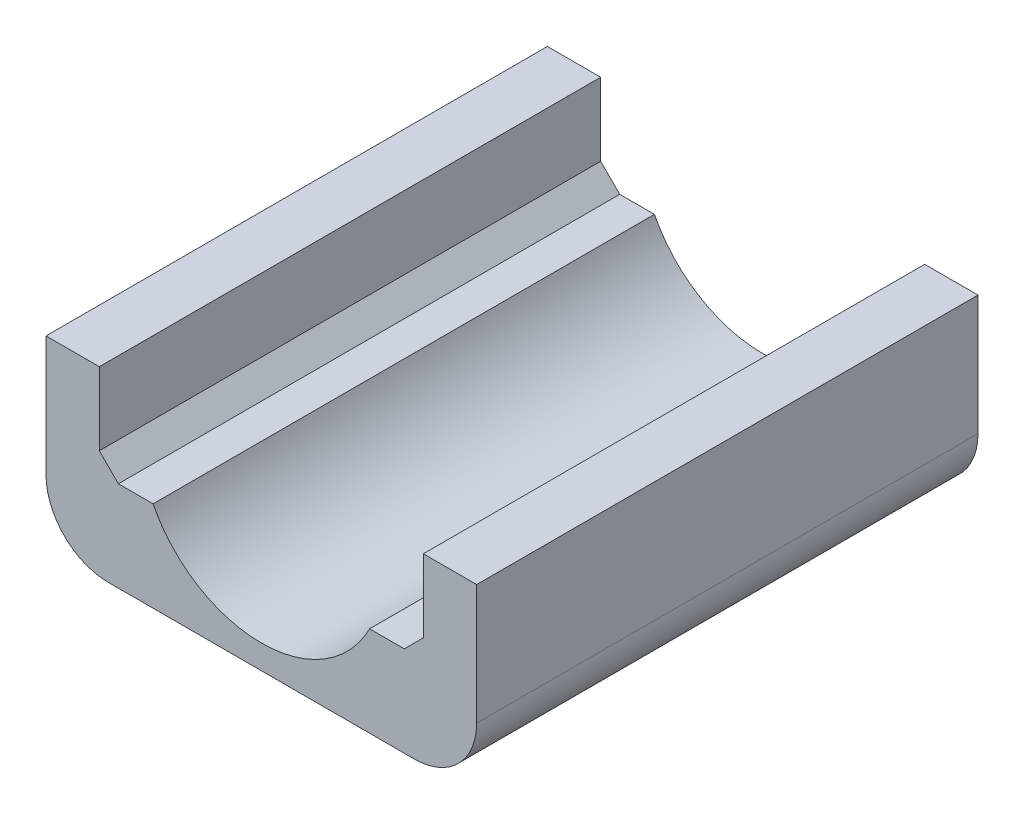
from build123d import *

# Parameters (mm, degrees)
BOSS_EXTRUDE1_DEPTH = 80.5


with BuildPart() as part:
    # Sketch1 → Boss-Extrude1 (new body)
    with BuildSketch(Plane.XY):
        with BuildLine():
            Line((-22.496419286, 29.27), (-22.496419286, 10))
            ThreePointArc((-22.496419286, 10), (-19.567487097, 2.928932188), (-12.496419286, 0))
            Line((-12.496419286, 0), (36.648732275, 0))
            ThreePointArc((36.648732275, 0), (43.719800087, 2.928932188), (46.648732275, 10))
            Line((46.648732275, 10), (46.648732275, 29.27))
            Line((46.648732275, 29.27), (38.088732275, 29.27))
            Line((38.088732275, 29.27), (38.088732275, 17.58))
            Line((38.088732275, 17.58), (35.026959912, 14.518227637))
            Line((35.026959912, 14.518227637), (29.456959912, 14.518227637))
            ThreePointArc((29.456959912, 14.518227637), (12.076156495, 3.858910448), (-5.304646923, 14.518227637))
            Line((-5.304646923, 14.518227637), (-10.874646923, 14.518227637))
            Line((-10.874646923, 14.518227637), (-13.936419286, 17.58))
            Line((-13.936419286, 17.58), (-13.936419286, 29.27))
            Line((-13.936419286, 29.27), (-22.496419286, 29.27))
        make_face()
    extrude(amount=BOSS_EXTRUDE1_DEPTH)


solid = part.part
